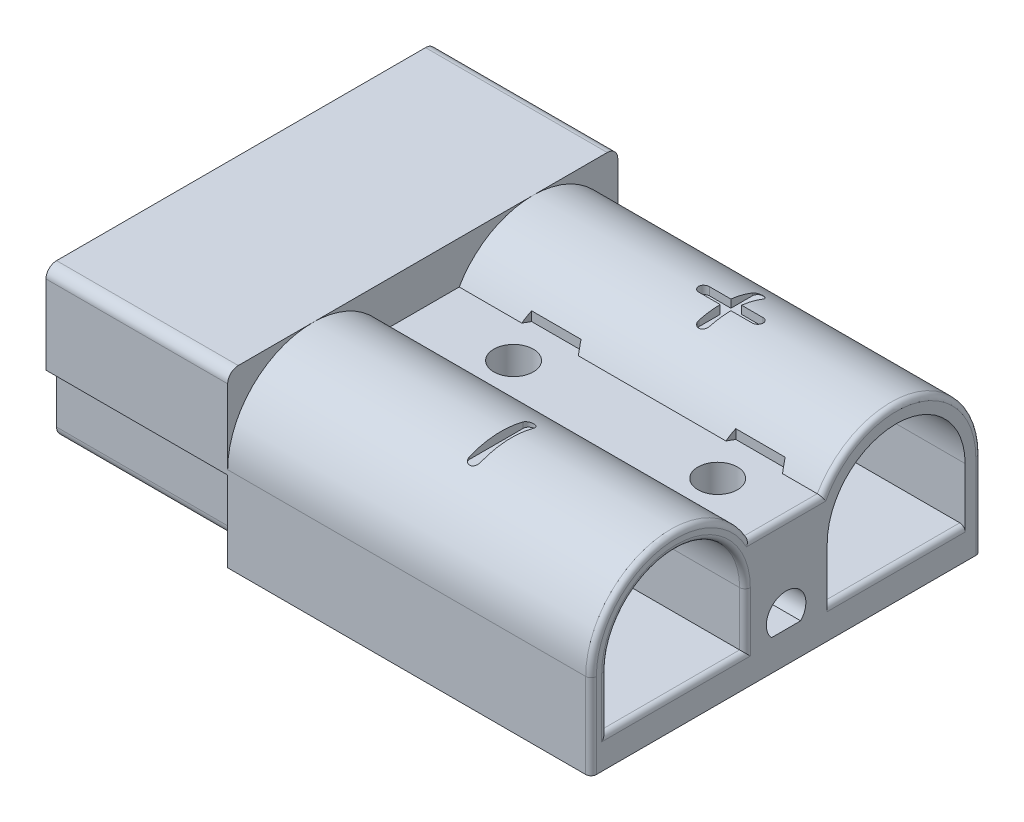
from build123d import *

# Parameters (mm, degrees)
EXTRUDE1_DEPTH  = 34
FILLET9_R       = 0.5
EXTRUDE8_DEPTH  = 2
EXTRUDE9_DEPTH  = 15
SKETCH22_R      = 1.85
EXTRUDE5_DEPTH  = 32.7
EXTRUDE6_DEPTH  = 2.7
EXTRUDE13_DEPTH = 0.8
EXTRUDE14_DEPTH = 0.25


with BuildPart() as part:
    # Sketch2 → Extrude1 (new body)
    with BuildSketch(Plane(origin=(0, 0, 0), x_dir=(0, 0, -1), z_dir=(1, 0, 0))):
        with BuildLine():
            Line((-18.25, -29.777392851), (18.25, -29.777392851))
            Line((18.25, -29.777392851), (18.25, -21.827392851))
            ThreePointArc((18.25, -21.827392851), (12.357611409, -14.148282532), (3.41509804, -17.852392851))
            Line((3.41509804, -17.852392851), (-3.41509804, -17.852392851))
            ThreePointArc((-3.41509804, -17.852392851), (-12.357611409, -14.148282532), (-18.25, -21.827392851))
            Line((-18.25, -21.827392851), (-18.25, -29.777392851))
        make_face()
        with BuildLine():
            Line((-16.75, -21.827392851), (-16.75, -26.877392851))
            Line((-16.75, -26.877392851), (-3.85, -26.877392851))
            Line((-3.85, -26.877392851), (-3.85, -21.827392851))
            ThreePointArc((-3.85, -21.827392851), (-10.3, -15.377392851), (-16.75, -21.827392851))
        make_face(mode=Mode.SUBTRACT)
        with BuildLine():
            Line((3.85, -26.877392851), (16.75, -26.877392851))
            Line((16.75, -26.877392851), (16.75, -21.827392851))
            ThreePointArc((16.75, -21.827392851), (10.3, -15.377392851), (3.85, -21.827392851))
            Line((3.85, -21.827392851), (3.85, -26.877392851))
        make_face(mode=Mode.SUBTRACT)
        with BuildLine():
            Line((-1.36381817, -26.877392851), (1.36381817, -26.877392851))
            ThreePointArc((1.36381817, -26.877392851), (0, -23.777392851), (-1.36381817, -26.877392851))
        make_face(mode=Mode.SUBTRACT)
    extrude(amount=EXTRUDE1_DEPTH)

    # Fillet9
    fillet9_edges = [part.edges().sort_by_distance(p)[0] for p in [
        (34, -25.802392851, -18.25),
        (34, -14.148282532, -12.357611409),
        (34, -17.852392851, 0),
        (34, -14.148282532, 12.357611409),
        (34, -26.877392851, -10.3),
        (34, -26.877392851, 10.3),
        (34, -24.352392851, 3.85),
        (34, -15.377392851, 10.3),
        (34, -24.352392851, 16.75),
        (34, -25.802392851, 18.25),
    ]]
    fillet(fillet9_edges, radius=FILLET9_R)

    # Sketch24 → Extrude8 (add)
    with BuildSketch(Plane.ZY):
        with BuildLine():
            Line((-17.261261, -27.362316651), (-17.261261, -22.382712698))
            Line((-17.261261, -22.382712698), (-17.261261, -22.259121198))
            Line((-17.261261, -22.259121198), (-18.249993, -22.259121198))
            Line((-18.249993, -22.259121198), (-18.249993, -14.866124851))
            ThreePointArc((-18.249993, -14.866124851), (-17.960400102, -14.166985749), (-17.261261, -13.877392851))
            Line((-17.261261, -13.877392851), (17.261261, -13.877392851))
            ThreePointArc((17.261261, -13.877392851), (17.960400102, -14.166985749), (18.249993, -14.866124851))
            Line((18.249993, -14.866124851), (18.249993, -22.259121198))
            Line((18.249993, -22.259121198), (17.261261, -22.259121198))
            Line((17.261261, -22.259121198), (17.261261, -22.382712698))
            Line((17.261261, -22.382712698), (17.261261, -27.362316651))
            ThreePointArc((17.261261, -27.362316651), (16.971668102, -28.061455753), (16.272529, -28.351048651))
            Line((16.272529, -28.351048651), (-16.272529, -28.351048651))
            ThreePointArc((-16.272529, -28.351048651), (-16.971668102, -28.061455753), (-17.261261, -27.362316651))
        make_face()
    extrude(amount=EXTRUDE8_DEPTH)

    # Sketch25 → Extrude9 (add)
    with BuildSketch(Plane.ZY.offset(2)):
        with BuildLine():
            Line((-17.261261, -13.877392851), (17.261261, -13.877392851))
            ThreePointArc((17.261261, -13.877392851), (17.960400102, -14.166985749), (18.249993, -14.866124851))
            Line((18.249993, -14.866124851), (18.249993, -22.259121198))
            Line((18.249993, -22.259121198), (17.261261, -22.259121198))
            Line((17.261261, -22.259121198), (17.261261, -14.866124851))
            Line((17.261261, -14.866124851), (0.494366, -14.866124851))
            Line((0.494366, -14.866124851), (0.494366, -18.821052851))
            Line((0.494366, -18.821052851), (0.988732, -18.821052851))
            Line((0.988732, -18.821052851), (0.988732, -19.809784851))
            Line((0.988732, -19.809784851), (-0.988732, -19.809784851))
            Line((-0.988732, -19.809784851), (-0.988732, -18.821052851))
            Line((-0.988732, -18.821052851), (-0.494366, -18.821052851))
            Line((-0.494366, -18.821052851), (-0.494366, -14.866124851))
            Line((-0.494366, -14.866124851), (-17.261261, -14.866124851))
            Line((-17.261261, -14.866124851), (-17.261261, -22.259121198))
            Line((-17.261261, -22.259121198), (-18.249993, -22.259121198))
            Line((-18.249993, -22.259121198), (-18.249993, -14.866124851))
            ThreePointArc((-18.249993, -14.866124851), (-17.960400102, -14.166985749), (-17.261261, -13.877392851))
        make_face()
        with BuildLine():
            Line((-17.261261, -27.362316651), (-17.261261, -22.382712698))
            Line((-17.261261, -22.382712698), (-16.272529, -22.382712698))
            Line((-16.272529, -22.382712698), (-16.272529, -23.371444698))
            Line((-16.272529, -23.371444698), (16.272529, -23.371444698))
            Line((16.272529, -23.371444698), (16.272529, -22.382712698))
            Line((16.272529, -22.382712698), (17.261261, -22.382712698))
            Line((17.261261, -22.382712698), (17.261261, -27.362316651))
            ThreePointArc((17.261261, -27.362316651), (16.971668102, -28.061455753), (16.272529, -28.351048651))
            Line((16.272529, -28.351048651), (1.977464, -28.351048651))
            ThreePointArc((1.977464, -28.351048651), (1.278324898, -28.061455753), (0.988732, -27.362316651))
            Line((0.988732, -27.362316651), (0.988732, -24.360176698))
            Line((0.988732, -24.360176698), (-0.988732, -24.360176698))
            Line((-0.988732, -24.360176698), (-0.988732, -27.362316651))
            ThreePointArc((-0.988732, -27.362316651), (-1.278324898, -28.061455753), (-1.977464, -28.351048651))
            Line((-1.977464, -28.351048651), (-16.272529, -28.351048651))
            ThreePointArc((-16.272529, -28.351048651), (-16.971668102, -28.061455753), (-17.261261, -27.362316651))
        make_face()
    extrude(amount=EXTRUDE9_DEPTH)

    # Sketch22 → Extrude5 (cut)
    with BuildSketch(Plane(origin=(0, -17.852392851, 0), x_dir=(-1, 0, 0), z_dir=(0, 1, 0))):
        with Locations(Location((-27.6, 0, 0), (0, 0, 90))):
            Circle(SKETCH22_R)
        with Locations(Location((-8.5, 0, 0), (0, 0, 90))):
            Circle(SKETCH22_R)
    extrude(amount=-EXTRUDE5_DEPTH, mode=Mode.SUBTRACT)

    # Sketch23 → Extrude6 (cut)
    with BuildSketch(Plane(origin=(0, -17.852392851, 0), x_dir=(-1, 0, 0), z_dir=(0, 1, 0))):
        Polygon((-29.909401077, 4), (-32.218802154, 0), (-29.909401077, -4), (-25.290598923, -4), (-22.981197846, 0), (-25.290598923, 4), align=None)
        Polygon((-10.809401077, 4), (-13.118802154, 0), (-10.809401077, -4), (-6.190598923, -4), (-3.881197846, 0), (-6.190598923, 4), align=None)
    extrude(amount=EXTRUDE6_DEPTH, mode=Mode.SUBTRACT)

    # Sketch29 → Extrude13 (cut)
    with BuildSketch(Plane(origin=(0, -13.877392851, 0), x_dir=(-1, 0, 0), z_dir=(0, 1, 0))):
        with BuildLine():
            Line((-17.605, -11.230046472), (-15.605, -11.230046472))
            ThreePointArc((-15.605, -11.230046472), (-15.105, -10.730046472), (-15.605, -10.230046472))
            Line((-15.605, -10.230046472), (-17.605, -10.230046472))
            Line((-17.605, -10.230046472), (-17.605, -8.230046472))
            ThreePointArc((-17.605, -8.230046472), (-18.105, -7.730046472), (-18.605, -8.230046472))
            Line((-18.605, -8.230046472), (-18.605, -10.230046472))
            Line((-18.605, -10.230046472), (-20.605, -10.230046472))
            ThreePointArc((-20.605, -10.230046472), (-21.105, -10.730046472), (-20.605, -11.230046472))
            Line((-20.605, -11.230046472), (-18.605, -11.230046472))
            Line((-18.605, -11.230046472), (-18.605, -13.230046472))
            ThreePointArc((-18.605, -13.230046472), (-18.105, -13.730046472), (-17.605, -13.230046472))
            Line((-17.605, -13.230046472), (-17.605, -11.230046472))
        make_face()
        with BuildLine():
            Line((-17.625, 13.230046472), (-17.625, 8.230046472))
            ThreePointArc((-17.625, 8.230046472), (-18.125, 7.730046472), (-18.625, 8.230046472))
            Line((-18.625, 8.230046472), (-18.625, 13.230046472))
            ThreePointArc((-18.625, 13.230046472), (-18.125, 13.730046472), (-17.625, 13.230046472))
        make_face()
    extrude(amount=-EXTRUDE13_DEPTH, mode=Mode.SUBTRACT)

    # Sketch32 → Extrude14 (cut)
    with BuildSketch(Plane.XZ.offset(28.351048651)):
        with BuildLine():
            Line((-9.3, -9.9249965), (-9.3, -13.1249965))
            ThreePointArc((-9.3, -13.1249965), (-8.5, -13.9249965), (-7.7, -13.1249965))
            Line((-7.7, -13.1249965), (-7.7, -9.9249965))
            Line((-7.7, -9.9249965), (-4.5, -9.9249965))
            ThreePointArc((-4.5, -9.9249965), (-3.7, -9.1249965), (-4.5, -8.3249965))
            Line((-4.5, -8.3249965), (-7.7, -8.3249965))
            Line((-7.7, -8.3249965), (-7.7, -5.1249965))
            ThreePointArc((-7.7, -5.1249965), (-8.5, -4.3249965), (-9.3, -5.1249965))
            Line((-9.3, -5.1249965), (-9.3, -8.3249965))
            Line((-9.3, -8.3249965), (-12.5, -8.3249965))
            ThreePointArc((-12.5, -8.3249965), (-13.3, -9.1249965), (-12.5, -9.9249965))
            Line((-12.5, -9.9249965), (-9.3, -9.9249965))
        make_face()
        with BuildLine():
            Line((-7.7, 13.1249965), (-7.7, 5.1249965))
            ThreePointArc((-7.7, 5.1249965), (-8.5, 4.3249965), (-9.3, 5.1249965))
            Line((-9.3, 5.1249965), (-9.3, 13.1249965))
            ThreePointArc((-9.3, 13.1249965), (-8.5, 13.9249965), (-7.7, 13.1249965))
        make_face()
    extrude(amount=-EXTRUDE14_DEPTH, mode=Mode.SUBTRACT)


solid = part.part
